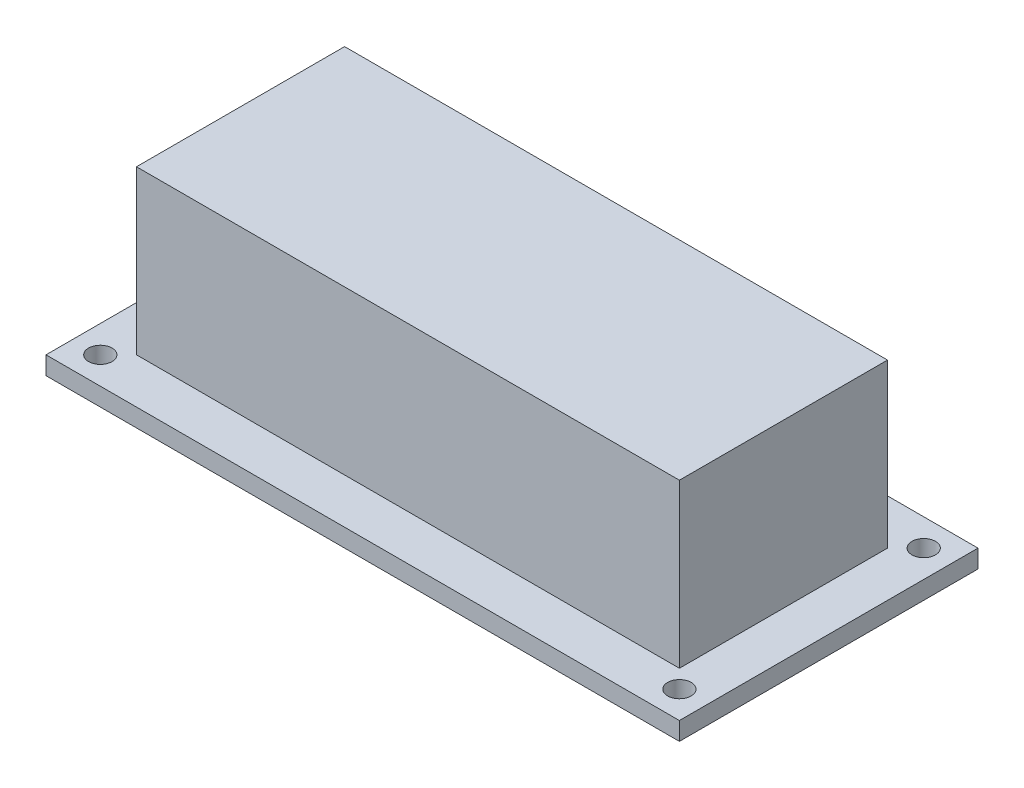
from build123d import *

# Parameters (mm, degrees)
SKETCH2_W           = 88.9
SKETCH2_H           = 41.91
BOSS_EXTRUDE1_DEPTH = 2.54
SKETCH3_R           = 1.651
CUT_EXTRUDE2_DEPTH  = 50.207378766
SKETCH4_W           = 76.2
SKETCH4_H           = 29.21
BOSS_EXTRUDE2_DEPTH = 22.86


with BuildPart() as part:
    # Sketch2 → Boss-Extrude1 (new body)
    with BuildSketch(Plane(origin=(0, 0, 0), x_dir=(1, 0, 0), z_dir=(0, 1, 0))):
        Rectangle(SKETCH2_W, SKETCH2_H)
    extrude(amount=BOSS_EXTRUDE1_DEPTH)

    # Sketch3 → Cut-Extrude2 (cut, through all)
    with BuildSketch(Plane(origin=(0, 0, 0), x_dir=(1, 0, 0), z_dir=(0, 1, 0))):
        with Locations(Location((-40.64, 17.145, 0), (0, 0, 270))):
            Circle(SKETCH3_R)
        with Locations(Location((40.64, 17.145, 0), (0, 0, 270))):
            Circle(SKETCH3_R)
        with Locations(Location((40.64, -17.145, 0), (0, 0, 270))):
            Circle(SKETCH3_R)
        with Locations(Location((-40.64, -17.145, 0), (0, 0, 270))):
            Circle(SKETCH3_R)
    extrude(amount=CUT_EXTRUDE2_DEPTH, mode=Mode.SUBTRACT)

    # Sketch4 → Boss-Extrude2 (add)
    with BuildSketch(Plane(origin=(0, 2.54, 0), x_dir=(1, 0, 0), z_dir=(0, 1, 0))):
        Rectangle(SKETCH4_W, SKETCH4_H)
    extrude(amount=BOSS_EXTRUDE2_DEPTH)


solid = part.part
